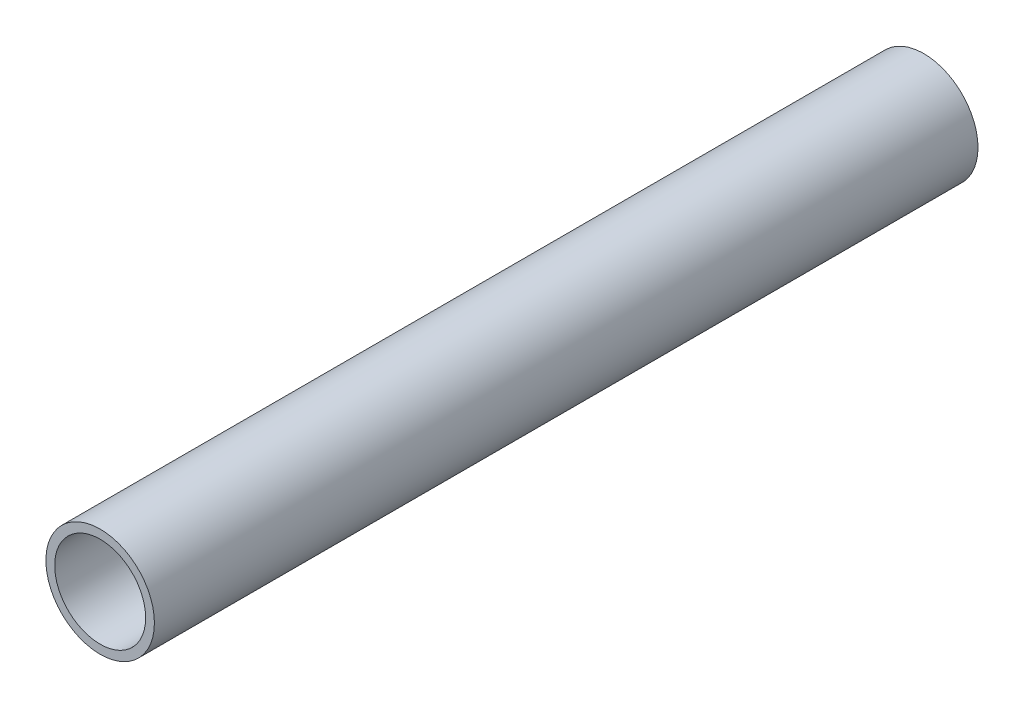
from build123d import *

# Parameters (mm, degrees)
SKETCH1_R           = 30.3
SKETCH1_R_2         = 25.4
BOSS_EXTRUDE1_DEPTH = 460


with BuildPart() as part:
    # Sketch1 → Boss-Extrude1 (new body)
    with BuildSketch(Plane.XY):
        Circle(SKETCH1_R)
        Circle(SKETCH1_R_2, mode=Mode.SUBTRACT)
    extrude(amount=BOSS_EXTRUDE1_DEPTH)


solid = part.part
